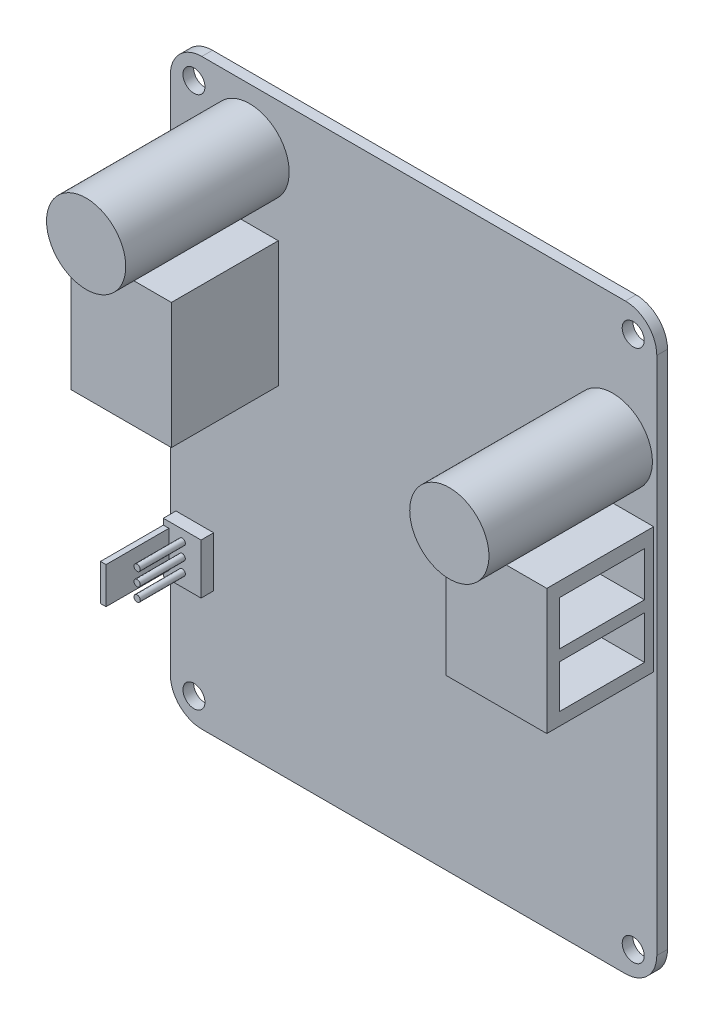
from build123d import *

# Parameters (mm, degrees)
SKETCH1_R           = 1.75
BOSS_EXTRUDE1_DEPTH = 1.7
SKETCH2_R           = 6.3
BOSS_EXTRUDE2_DEPTH = 26
SKETCH3_W           = 16
SKETCH3_H           = 20
BOSS_EXTRUDE3_DEPTH = 17
SKETCH4_W           = 13.854016079
SKETCH4_H           = 7.22206482
SKETCH4_H_2         = 7.167084928
CUT_EXTRUDE1_DEPTH  = 13
SKETCH5_W           = 13.539526547
SKETCH5_H           = 7.062187725
SKETCH5_H_2         = 6.849826242
CUT_EXTRUDE2_DEPTH  = 13
SKETCH6_W           = 6
SKETCH6_H           = 8
BOSS_EXTRUDE5_DEPTH = 12
SKETCH7_R           = 0.5
CUT_EXTRUDE3_DEPTH  = 10
SKETCH8_W           = 2.826271855
SKETCH8_H           = 5.802654235
CUT_EXTRUDE4_DEPTH  = 123.76480237


with BuildPart() as part:
    # Sketch1 → Boss-Extrude1 (new body)
    with BuildSketch(Plane.XY):
        with BuildLine():
            Line((5, 0), (72.37, 0))
            ThreePointArc((72.37, 0), (75.905533906, 1.464466094), (77.37, 5))
            Line((77.37, 5), (77.37, 87.67))
            ThreePointArc((77.37, 87.67), (75.905533906, 91.205533906), (72.37, 92.67))
            Line((72.37, 92.67), (5, 92.67))
            ThreePointArc((5, 92.67), (1.464466094, 91.205533906), (0, 87.67))
            Line((0, 87.67), (0, 5))
            ThreePointArc((0, 5), (1.464466094, 1.464466094), (5, 0))
        make_face()
        with Locations((73.62, 88.72)):
            Circle(SKETCH1_R, mode=Mode.SUBTRACT)
        with Locations(Location((3.75, 88.72, 0), (0, 0, 180))):
            Circle(SKETCH1_R, mode=Mode.SUBTRACT)
        with Locations((3.75, 3.95)):
            Circle(SKETCH1_R, mode=Mode.SUBTRACT)
        with Locations(Location((73.62, 3.95, 0), (0, 0, 180))):
            Circle(SKETCH1_R, mode=Mode.SUBTRACT)
    extrude(amount=BOSS_EXTRUDE1_DEPTH)

    # Sketch2 → Boss-Extrude2 (add)
    with BuildSketch(Plane.XY.offset(1.7)):
        with Locations(Location((12.6, 83.67, 0), (0, 0, 180))):
            Circle(SKETCH2_R)
        with Locations(Location((70.37, 72.67, 0), (0, 0, 180))):
            Circle(SKETCH2_R)
    extrude(amount=BOSS_EXTRUDE2_DEPTH)

    # Sketch3 → Boss-Extrude3 (add)
    with BuildSketch(Plane.XY.offset(1.7)):
        with Locations((68.875904293, 53.835144036)):
            Rectangle(SKETCH3_W, SKETCH3_H)
        with Locations((9.163906292, 63.368262293)):
            Rectangle(SKETCH3_W, SKETCH3_H)
    extrude(amount=BOSS_EXTRUDE3_DEPTH)

    # Sketch4 → Cut-Extrude1 (cut)
    with BuildSketch(Plane.ZY.offset(-1.163906292)):
        with Locations((10.29633171, 67.739791882)):
            Rectangle(SKETCH4_W, SKETCH4_H)
        with Locations((10.29633171, 58.701978818)):
            Rectangle(SKETCH4_W, SKETCH4_H_2)
    extrude(amount=-CUT_EXTRUDE1_DEPTH, mode=Mode.SUBTRACT)

    # Sketch5 → Cut-Extrude2 (cut)
    with BuildSketch(Plane(origin=(76.875904293, 0, 0), x_dir=(0, 0, -1), z_dir=(1, 0, 0))):
        with Locations((-9.923616317, 58.019849725)):
            Rectangle(SKETCH5_W, SKETCH5_H)
        with Locations((-9.923616317, 49.287198962)):
            Rectangle(SKETCH5_W, SKETCH5_H_2)
    extrude(amount=-CUT_EXTRUDE2_DEPTH, mode=Mode.SUBTRACT)

    # Sketch6 → Boss-Extrude5 (add)
    with BuildSketch(Plane.XY.offset(1.7)):
        with Locations((3.883233482, 24)):
            Rectangle(SKETCH6_W, SKETCH6_H)
    extrude(amount=BOSS_EXTRUDE5_DEPTH)

    # Sketch7 → Cut-Extrude3 (cut)
    with BuildSketch(Plane.XY.offset(13.7)):
        Polygon((6.883233482, 28), (0.883233482, 28), (0.883233482, 27.053748642), (1.764591458, 27.053748642), (1.764591458, 21.251094407), (0.883233482, 21.251094407), (0.883233482, 20), (6.883233482, 20), align=None)
        with Locations((3.883233482, 22.03910918)):
            Circle(SKETCH7_R, mode=Mode.SUBTRACT)
        with Locations((3.883233482, 24.152421525)):
            Circle(SKETCH7_R, mode=Mode.SUBTRACT)
        with Locations((3.883233482, 26.265733869)):
            Circle(SKETCH7_R, mode=Mode.SUBTRACT)
    extrude(amount=-CUT_EXTRUDE3_DEPTH, mode=Mode.SUBTRACT)

    # Sketch8 → Cut-Extrude4 (cut, through all)
    with BuildSketch(Plane(origin=(1.764591458, 0, 0), x_dir=(0, 0, -1), z_dir=(1, 0, 0))):
        with Locations((-12.286864073, 24.152421524)):
            Rectangle(SKETCH8_W, SKETCH8_H)
    extrude(amount=CUT_EXTRUDE4_DEPTH, mode=Mode.SUBTRACT)


solid = part.part
